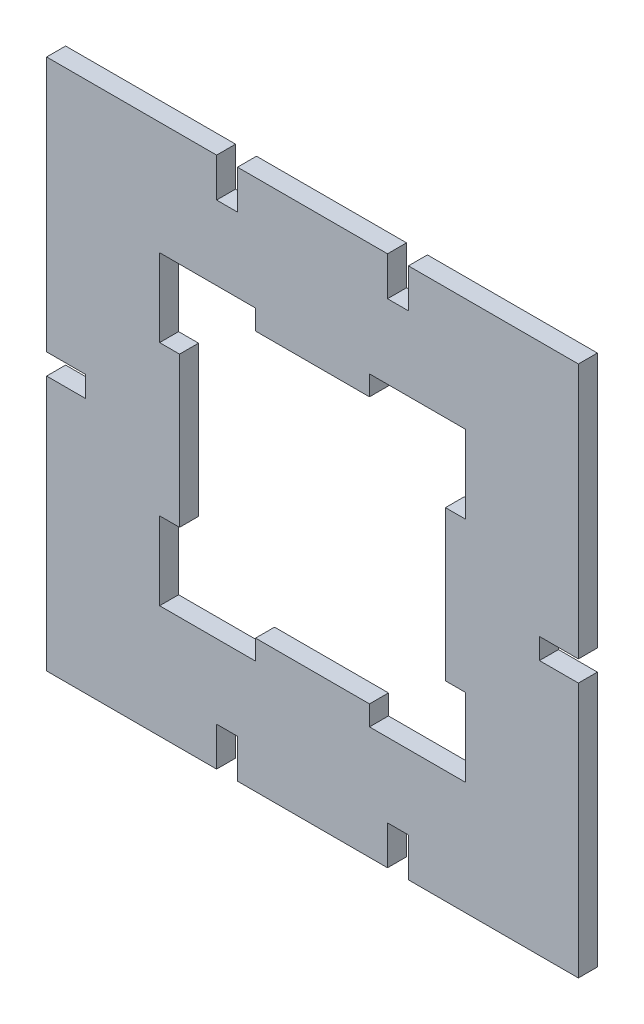
from build123d import *

# Parameters (mm, degrees)
BOSS_EXTRUDE1_DEPTH = 2.5


with BuildPart() as part:
    # Sketch2 → Boss-Extrude1 (new, symmetric)
    with BuildSketch(Plane.XY):
        Polygon((-936.252975542, -80.979102057), (-936.252975542, -13.729117514), (-891.502975542, -13.729117514), (-891.502975542, -23.979117514), (-886.002975542, -23.979117514), (-886.002975542, -13.729117514), (-846.502975542, -13.729117514), (-846.502975542, -23.979117514), (-841.002975542, -23.979117514), (-841.002975542, -13.729117514), (-796.252975542, -13.729117514), (-796.252975542, -80.979102057), (-806.502975542, -80.979102057), (-806.502975542, -86.479102057), (-796.252975542, -86.479102057), (-796.252975542, -153.729086599), (-841.002975542, -153.729086599), (-841.002975542, -143.479086599), (-846.502975542, -143.479086599), (-846.502975542, -153.729086599), (-886.002975542, -153.729086599), (-886.002975542, -143.479086599), (-891.502975542, -143.479086599), (-891.502975542, -153.729086599), (-936.252975542, -153.729086599), (-936.252975542, -86.479102057), (-926.002975542, -86.479102057), (-926.002975542, -80.979102057), align=None)
        Polygon((-881.252975542, -43.479117514), (-881.252975542, -48.729117514), (-851.252975542, -48.729117514), (-851.252975542, -43.479117514), (-826.002975542, -43.479117514), (-826.002975542, -63.979117514), (-831.252975542, -63.979117514), (-831.252975542, -103.479086599), (-826.002975542, -103.479086599), (-826.002975542, -123.979086599), (-851.252975542, -123.979086599), (-851.252975542, -118.729086599), (-881.252975542, -118.729086599), (-881.252975542, -123.979086599), (-906.502975542, -123.979086599), (-906.502975542, -103.479086599), (-901.252975542, -103.479086599), (-901.252975542, -63.979117514), (-906.502975542, -63.979117514), (-906.502975542, -43.479117514), align=None, mode=Mode.SUBTRACT)
    extrude(amount=BOSS_EXTRUDE1_DEPTH, both=True)


solid = part.part
